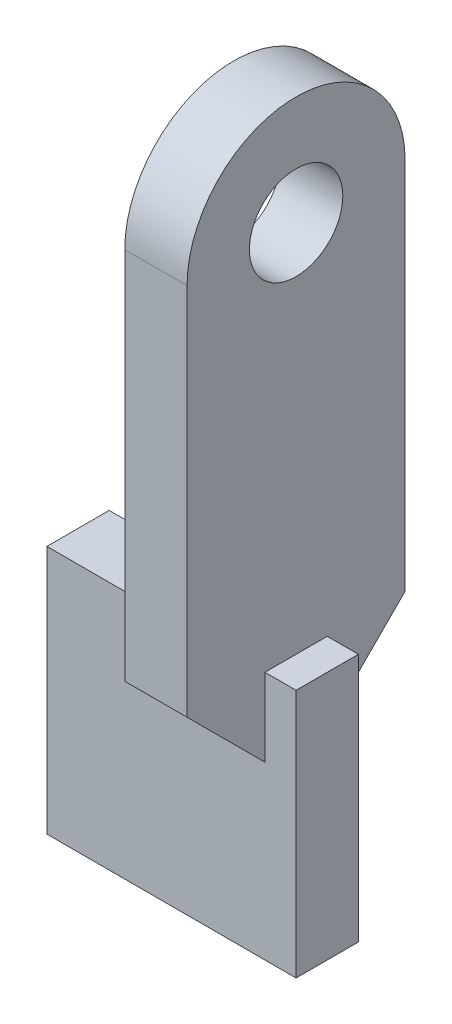
from build123d import *

# Parameters (mm, degrees)
SKETCH1_R           = 1.5
BOSS_EXTRUDE1_DEPTH = 1
SKETCH2_W           = 8
SKETCH2_H           = 8
BOSS_EXTRUDE2_DEPTH = 1
BOSS_EXTRUDE3_DEPTH = 1


with BuildPart() as part:
    # Sketch1 → Boss-Extrude1 (new, symmetric)
    with BuildSketch(Plane(origin=(0, 0, 0), x_dir=(0, 0, -1), z_dir=(1, 0, 0))):
        with BuildLine():
            Line((-3.5, 0), (-3.5, -12))
            Line((-3.5, -12), (3.5, -12))
            Line((3.5, -12), (3.5, 0))
            ThreePointArc((3.5, 0), (0, 3.5), (-3.5, 0))
        make_face()
        Circle(SKETCH1_R, mode=Mode.SUBTRACT)
    extrude(amount=BOSS_EXTRUDE1_DEPTH, both=True)

    # Sketch2 → Boss-Extrude2 (add, symmetric)
    with BuildSketch(Plane.XY):
        with Locations((-2, -16)):
            Rectangle(SKETCH2_W, SKETCH2_H)
    extrude(amount=BOSS_EXTRUDE2_DEPTH, both=True)

    # Sketch3 → Boss-Extrude3 (add, symmetric)
    with BuildSketch(Plane(origin=(0, 0, 0), x_dir=(0, 0, -1), z_dir=(1, 0, 0))):
        Polygon((-3.5, -12), (-1, -14.5), (-1, -12), align=None)
        Polygon((1, -12), (3.5, -12), (1, -14.5), align=None)
    extrude(amount=BOSS_EXTRUDE3_DEPTH, both=True)


solid = part.part
